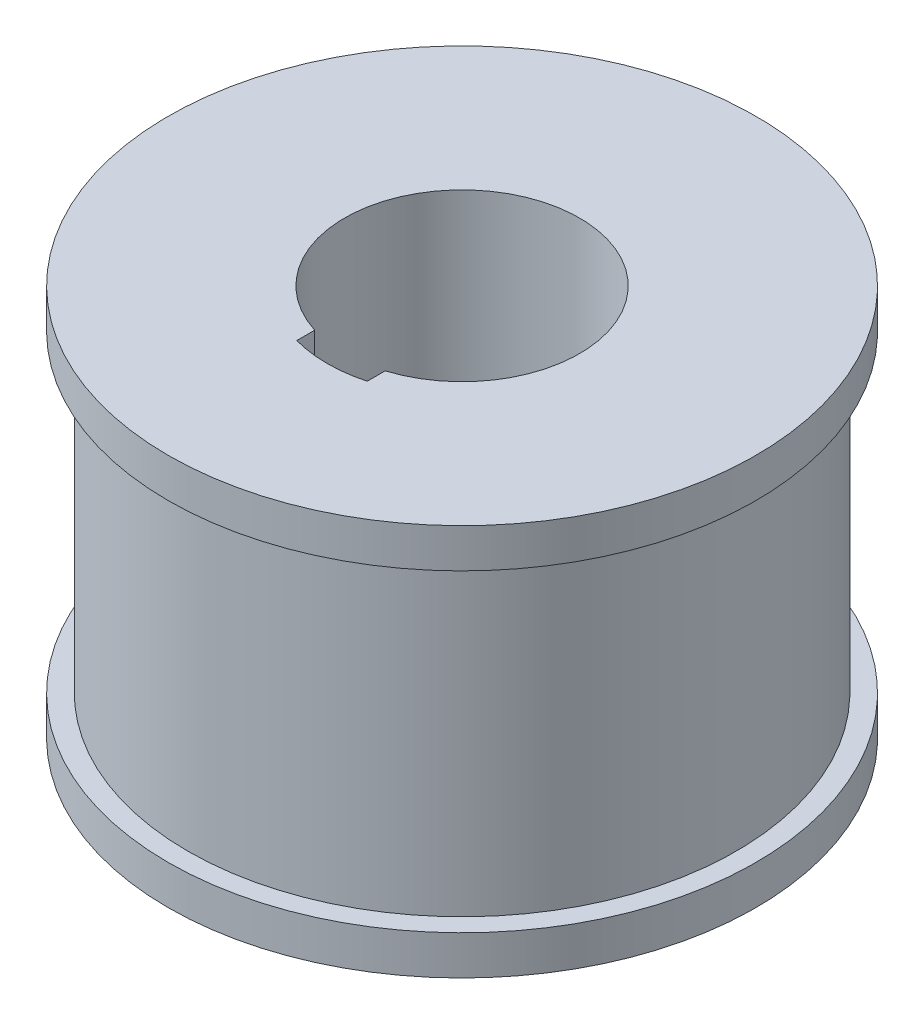
from build123d import *

# Parameters (mm, degrees)
SKETCH1_R           = 70
SKETCH1_R_2         = 30
BOSS_EXTRUDE1_DEPTH = 40
SKETCH2_R           = 75
SKETCH2_R_2         = 30
BOSS_EXTRUDE2_DEPTH = 10
CUT_EXTRUDE1_DEPTH  = 146.773797371


with BuildPart() as part:
    # Sketch1 → Boss-Extrude1 (new, symmetric)
    with BuildSketch(Plane(origin=(0, 0, 0), x_dir=(1, 0, 0), z_dir=(0, 1, 0))):
        with Locations(Location((0, 0, 0), (0, 0, 270))):
            Circle(SKETCH1_R)
        with Locations(Location((0, 0, 0), (0, 0, 270))):
            Circle(SKETCH1_R_2, mode=Mode.SUBTRACT)
    extrude(amount=BOSS_EXTRUDE1_DEPTH, both=True)

    # Sketch2 → Boss-Extrude2 (add)
    with BuildSketch(Plane(origin=(0, 40, 0), x_dir=(1, 0, 0), z_dir=(0, 1, 0))):
        with Locations(Location((0, 0, 0), (0, 0, 270))):
            Circle(SKETCH2_R)
        with Locations(Location((0, 0, 0), (0, 0, 270))):
            Circle(SKETCH2_R_2, mode=Mode.SUBTRACT)
    boss_extrude2 = extrude(amount=BOSS_EXTRUDE2_DEPTH)

    # Mirror1: Boss-Extrude2 across plane
    add(boss_extrude2.mirror(Plane.ZX))

    # Sketch3 → Cut-Extrude1 (cut, through all)
    with BuildSketch(Plane.XZ.offset(50)):
        with BuildLine():
            Line((-9, 33.20180718), (-9, 19.467949782))
            Line((-9, 19.467949782), (9, 19.467949782))
            Line((9, 19.467949782), (9, 33.20180718))
            ThreePointArc((9, 33.20180718), (0, 34.4), (-9, 33.20180718))
        make_face()
    extrude(amount=-CUT_EXTRUDE1_DEPTH, mode=Mode.SUBTRACT)


solid = part.part
